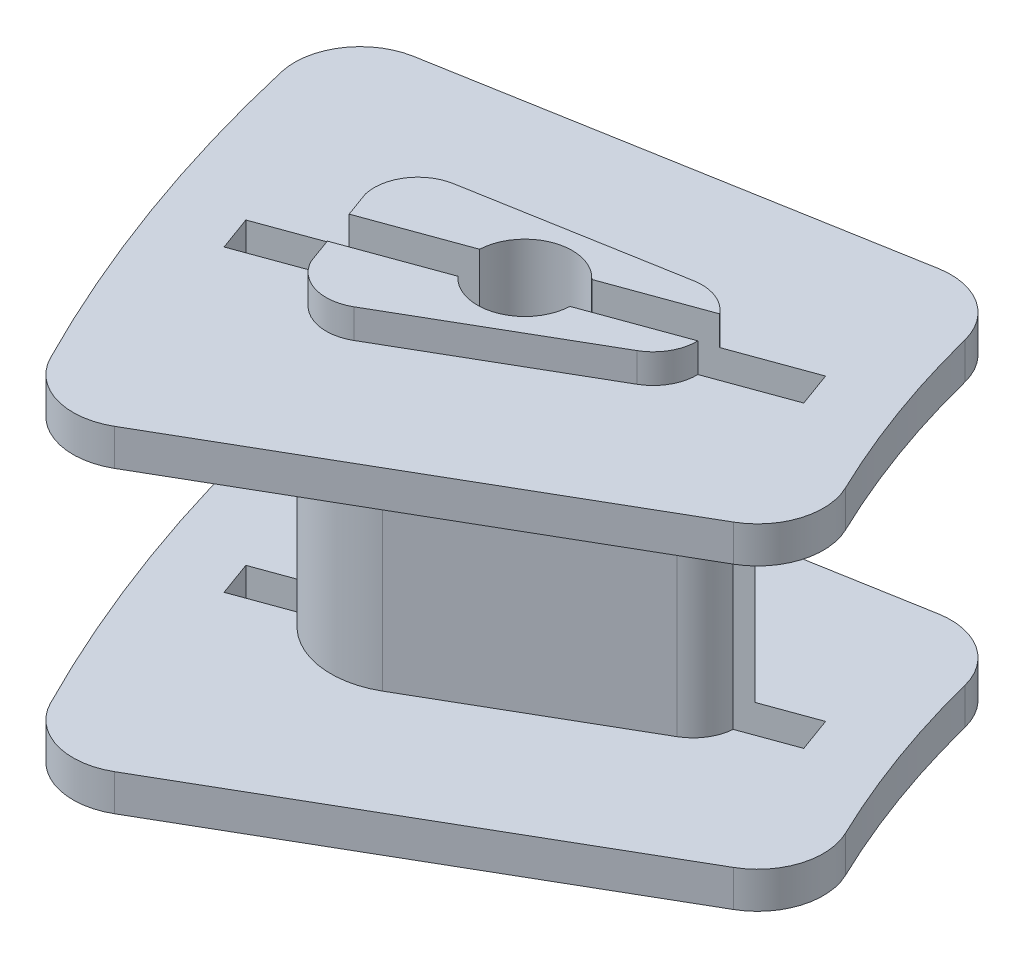
from build123d import *

# Parameters (mm, degrees)
BOSS_EXTRUDE1_DEPTH = 2.5
BOSS_EXTRUDE2_DEPTH = 18
CUT_EXTRUDE1_DEPTH  = 121.712224117
BOSS_EXTRUDE3_START = 2
BOSS_EXTRUDE3_DEPTH = 2


with BuildPart() as part:
    # Sketch1 → Boss-Extrude1 (new body)
    with BuildSketch(Plane(origin=(0, 0, 0), x_dir=(1, 0, 0), z_dir=(0, 1, 0))):
        with BuildLine():
            Line((-72.307015928, -13.524843261), (-102.896359968, -18.918569937))
            ThreePointArc((-102.896359968, -18.918569937), (-105.867796955, -20.867043845), (-106.499308602, -24.363782522))
            ThreePointArc((-106.499308602, -24.363782522), (-102.726730434, -37.092873959), (-97.434590717, -49.268890224))
            ThreePointArc((-97.434590717, -49.268890224), (-94.703164434, -51.541619594), (-91.174456756, -51.124234325))
            Line((-91.174456756, -51.124234325), (-64.274639058, -35.593617336))
            ThreePointArc((-64.274639058, -35.593617336), (-62.224627836, -33.023116562), (-62.470083693, -29.74443212))
            ThreePointArc((-62.470083693, -29.74443212), (-65.139025602, -23.412068226), (-67.164862535, -16.845633263))
            ThreePointArc((-67.164862535, -16.845633263), (-69.084330175, -14.176239282), (-72.307015928, -13.524843261))
        make_face()
    boss_extrude1 = extrude(amount=BOSS_EXTRUDE1_DEPTH)

    # Sketch2 → Boss-Extrude2 (add)
    with BuildSketch(Plane(origin=(0, 2.5, 0), x_dir=(1, 0, 0), z_dir=(0, 1, 0))):
        with BuildLine():
            Line((-75.996588964, -24.219866543), (-90.54428362, -26.785017618))
            ThreePointArc((-90.54428362, -26.785017618), (-94.837750272, -34.221520002), (-86.76867241, -37.158424161))
            Line((-86.76867241, -37.158424161), (-73.975644431, -29.772366014))
            ThreePointArc((-73.975644431, -29.772366014), (-72.656566568, -26.148229372), (-75.996588964, -24.219866543))
        make_face()
    extrude(amount=BOSS_EXTRUDE2_DEPTH)

    # Mirror1: Boss-Extrude1 across plane
    add(boss_extrude1.mirror(Plane.ZX.offset(11.5)))

    # Sketch4 → Cut-Extrude1 (cut, through all)
    with BuildSketch(Plane(origin=(0, 23, 0), x_dir=(1, 0, 0), z_dir=(0, 1, 0))):
        with BuildLine():
            Line((-98.925638819, -34.379167538), (-87.179481059, -30.103915746))
            ThreePointArc((-87.179481059, -30.103915746), (-85.044443484, -27.198470075), (-81.541325335, -28.051794886))
            Line((-81.541325335, -28.051794886), (-69.795167575, -23.776543095))
            Line((-69.795167575, -23.776543095), (-68.940117216, -26.125774647))
            Line((-68.940117216, -26.125774647), (-80.686274976, -30.401026438))
            ThreePointArc((-80.686274976, -30.401026438), (-82.821312552, -33.30647211), (-86.324430701, -32.453147298))
            Line((-86.324430701, -32.453147298), (-98.070588461, -36.72839909))
            Line((-98.070588461, -36.72839909), (-98.925638819, -34.379167538))
        make_face()
    extrude(amount=-CUT_EXTRUDE1_DEPTH, mode=Mode.SUBTRACT)

    # Sketch5 → Boss-Extrude3 (add)
    with BuildSketch(Plane(origin=(0, 23, 0), x_dir=(1, 0, 0), z_dir=(0, 1, 0)).offset(BOSS_EXTRUDE3_START)):
        with BuildLine():
            Line((-88.070170969, -37.828843014), (-75.758777587, -30.720856731))
            ThreePointArc((-75.758777587, -30.720856731), (-74.645598026, -29.596311171), (-74.25939673, -28.061834057))
            Line((-74.25939673, -28.061834057), (-80.686274976, -30.401026438))
            ThreePointArc((-80.686274976, -30.401026438), (-82.821312552, -33.30647211), (-86.324430701, -32.453147298))
            Line((-86.324430701, -32.453147298), (-92.880168291, -34.839240645))
            Line((-92.880168291, -34.839240645), (-92.238880522, -36.601164309))
            ThreePointArc((-92.238880522, -36.601164309), (-90.417678642, -38.108566439), (-88.070170969, -37.828843014))
        make_face()
        with BuildLine():
            Line((-77.97222629, -24.6394564), (-91.97222629, -27.108034129))
            ThreePointArc((-91.97222629, -27.108034129), (-93.95032425, -28.4027024), (-94.376506418, -30.728085429))
            Line((-94.376506418, -30.728085429), (-93.735218649, -32.490009093))
            Line((-93.735218649, -32.490009093), (-87.179481059, -30.103915746))
            ThreePointArc((-87.179481059, -30.103915746), (-85.044443484, -27.198470075), (-81.541325335, -28.051794886))
            Line((-81.541325335, -28.051794886), (-75.114447088, -25.712602505))
            ThreePointArc((-75.114447088, -25.712602505), (-76.396637321, -24.785370248), (-77.97222629, -24.6394564))
        make_face()
    extrude(amount=-BOSS_EXTRUDE3_DEPTH)


solid = part.part
